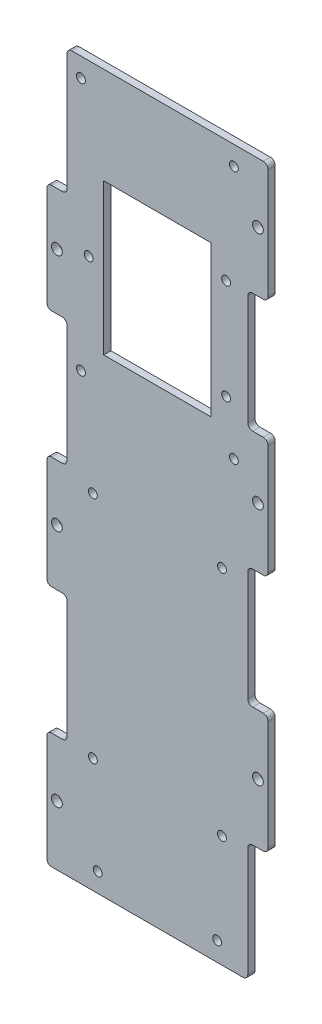
from build123d import *

# Parameters (mm, degrees)
SKETCH1_W           = 92.6
SKETCH1_H           = 300
BOSS_EXTRUDE1_DEPTH = 3
SKETCH2_R           = 2.25
SKETCH2_W           = 8.48
SKETCH2_H           = 53
SKETCH2_H_2         = 50
CUT_EXTRUDE5_DEPTH  = 10
FILLET3_R           = 2
SKETCH4_R           = 1.85
CUT_EXTRUDE6_DEPTH  = 10
SKETCH5_R           = 1.85
CUT_EXTRUDE7_DEPTH  = 5
SKETCH6_W           = 45
SKETCH6_H           = 63.1
CUT_EXTRUDE8_DEPTH  = 10


with BuildPart() as part:
    # Sketch1 → Boss-Extrude1 (new body)
    with BuildSketch(Plane.XY):
        Rectangle(SKETCH1_W, SKETCH1_H)
    extrude(amount=BOSS_EXTRUDE1_DEPTH)

    # Sketch2 → Cut-Extrude5 (cut)
    with BuildSketch(Plane.XY):
        with Locations((-42.06, 75)):
            Circle(SKETCH2_R)
        with Locations((42.06, 125)):
            Circle(SKETCH2_R)
        with Locations((42.06, 25)):
            Circle(SKETCH2_R)
        with Locations((42.06, -75)):
            Circle(SKETCH2_R)
        with Locations((-42.06, -25)):
            Circle(SKETCH2_R)
        with Locations((-42.06, -125)):
            Circle(SKETCH2_R)
        with Locations((-42.06, 123.5)):
            Rectangle(SKETCH2_W, SKETCH2_H)
        with Locations((42.06, 75)):
            Rectangle(SKETCH2_W, SKETCH2_H_2)
        with Locations((42.06, -25)):
            Rectangle(SKETCH2_W, SKETCH2_H_2)
        with Locations((-42.06, 25)):
            Rectangle(SKETCH2_W, SKETCH2_H)
        with Locations((-42.06, -75)):
            Rectangle(SKETCH2_W, SKETCH2_H)
        with Locations((42.06, -125)):
            Rectangle(SKETCH2_W, SKETCH2_H_2)
    extrude(amount=CUT_EXTRUDE5_DEPTH, mode=Mode.SUBTRACT)

    # Fillet3
    fillet3_edges = [part.edges().sort_by_distance(p)[0] for p in [
        (46.3, -100, 1.5),
        (37.82, -100, 1.5),
        (37.82, -150, 1.5),
        (46.3, 50, 1.5),
        (46.3, 100, 1.5),
        (37.82, 100, 1.5),
        (37.82, 50, 1.5),
        (-46.3, -48.5, 1.5),
        (-46.3, -101.5, 1.5),
        (-37.82, -101.5, 1.5),
        (-37.82, -48.5, 1.5),
        (37.82, 0, 1.5),
        (37.82, -50, 1.5),
        (46.3, -50, 1.5),
        (46.3, 0, 1.5),
        (46.3, 150, 1.5),
        (-46.3, 51.5, 1.5),
        (-46.3, -150, 1.5),
        (-46.3, -1.5, 1.5),
        (-37.82, -1.5, 1.5),
        (-37.82, 51.5, 1.5),
        (-46.3, 97, 1.5),
        (-37.82, 97, 1.5),
        (-37.82, 150, 1.5),
    ]]
    fillet(fillet3_edges, radius=FILLET3_R)

    # Sketch4 → Cut-Extrude6 (cut)
    with BuildSketch(Plane(origin=(0, 0, 0), x_dir=(-1, 0, 0), z_dir=(0, 0, -1))):
        with Locations((-25, -142)):
            Circle(SKETCH4_R)
        with Locations((25, -142)):
            Circle(SKETCH4_R)
        with Locations((32, 142)):
            Circle(SKETCH4_R)
        with Locations((-32, 142)):
            Circle(SKETCH4_R)
    extrude(amount=-CUT_EXTRUDE6_DEPTH, mode=Mode.SUBTRACT)

    # Sketch5 → Cut-Extrude7 (cut)
    with BuildSketch(Plane(origin=(0, 0, 0), x_dir=(-1, 0, 0), z_dir=(0, 0, -1))):
        with Locations((-28.75, 99)):
            Circle(SKETCH5_R)
        with Locations((28.75, 79.08)):
            Circle(SKETCH5_R)
        with Locations((-28.75, 57)):
            Circle(SKETCH5_R)
        with Locations((-32, 36)):
            Circle(SKETCH5_R)
        with Locations((32, 36)):
            Circle(SKETCH5_R)
        with Locations((-27, -6)):
            Circle(SKETCH5_R)
        with Locations((27, -6)):
            Circle(SKETCH5_R)
        with Locations((-27, -103.156683368)):
            Circle(SKETCH5_R)
        with Locations((27, -102)):
            Circle(SKETCH5_R)
    extrude(amount=-CUT_EXTRUDE7_DEPTH, mode=Mode.SUBTRACT)

    # Sketch6 → Cut-Extrude8 (cut)
    with BuildSketch(Plane(origin=(0, 0, 0), x_dir=(-1, 0, 0), z_dir=(0, 0, -1))):
        with Locations((0, 78)):
            Rectangle(SKETCH6_W, SKETCH6_H)
    extrude(amount=-CUT_EXTRUDE8_DEPTH, mode=Mode.SUBTRACT)


solid = part.part
